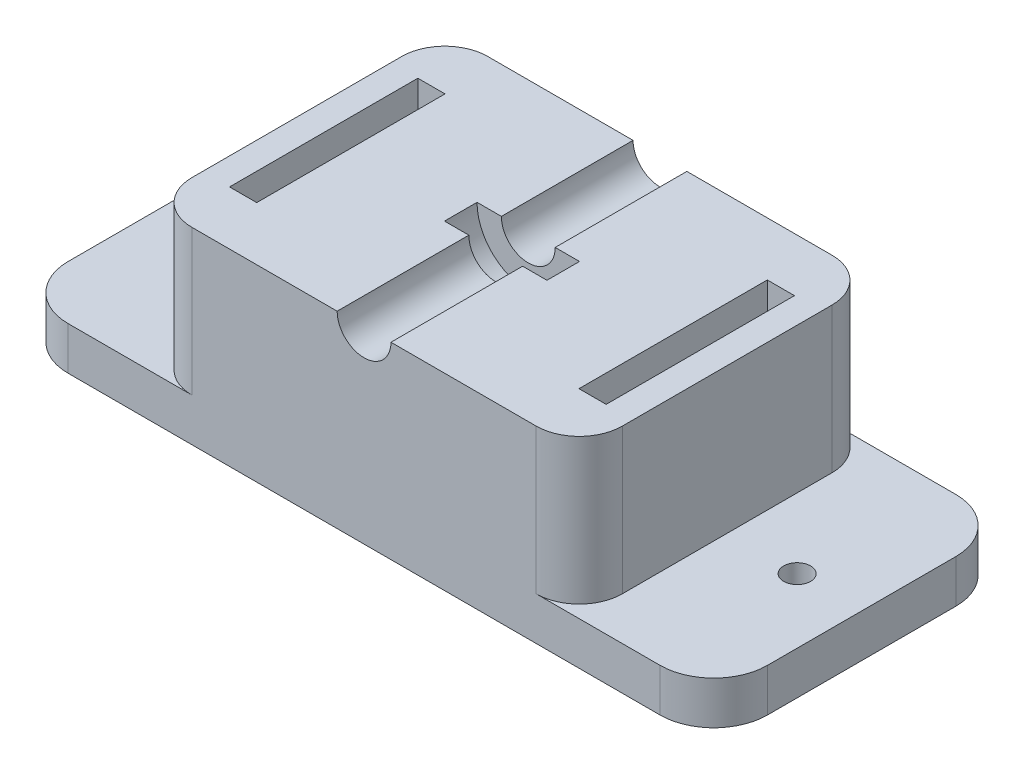
from build123d import *

# Parameters (mm, degrees)
SALIENTE_EXTRUIR1_DEPTH    = 55
CROQUIS2_R                 = 9.525
CORTAR_EXTRUIR1_DEPTH      = 3.025
CROQUIS3_W                 = 5.05
CROQUIS3_H                 = 35
CORTAR_EXTRUIR2_DEPTH      = 10
CORTAR_EXTRUIR3_DEPTH      = 79.779756283
CORTAR_EXTRUIR3_DEPTH_BACK = 79.779756283
CROQUIS4_R                 = 5
REDONDEO1_R                = 10
CROQUIS5_R                 = 2.5
CORTAR_EXTRUIR4_DEPTH      = 90.32524839
REDONDEO2_R                = 8


with BuildPart() as part:
    # Croquis1 → Saliente-Extruir1 (new body)
    with BuildSketch(Plane.XY):
        Polygon((-40, 0), (40, 0), (40, -27), (65, -27), (65, -35), (40, -35), (-40, -35), (-65, -35), (-65, -27), (-40, -27), align=None)
    extrude(amount=SALIENTE_EXTRUIR1_DEPTH)

    # Croquis2 → Cortar-Extruir1 (cut, symmetric)
    with BuildSketch(Plane.XY.offset(27.5)):
        Circle(CROQUIS2_R)
    extrude(amount=CORTAR_EXTRUIR1_DEPTH, both=True, mode=Mode.SUBTRACT)

    # Croquis3 → Cortar-Extruir2 (cut)
    with BuildSketch(Plane(origin=(0, 0, 0), x_dir=(1, 0, 0), z_dir=(0, 1, 0))):
        with Locations((-32.475, -27.5)):
            Rectangle(CROQUIS3_W, CROQUIS3_H)
        with Locations((32.475, -27.5)):
            Rectangle(CROQUIS3_W, CROQUIS3_H)
    extrude(amount=-CORTAR_EXTRUIR2_DEPTH, mode=Mode.SUBTRACT)

    # Croquis4 → Cortar-Extruir3 (cut, two sides: drawn at the far end of the back side and taken through both)
    with BuildSketch(Plane.XY.offset(27.5).offset(-CORTAR_EXTRUIR3_DEPTH_BACK)):
        Circle(CROQUIS4_R)
    extrude(amount=CORTAR_EXTRUIR3_DEPTH + CORTAR_EXTRUIR3_DEPTH_BACK, mode=Mode.SUBTRACT)

    # Redondeo1
    redondeo1_edges = [part.edges().sort_by_distance(p)[0] for p in [
        (65, -31, 0),
        (-65, -31, 0),
        (65, -31, 55),
        (-65, -31, 55),
    ]]
    fillet(redondeo1_edges, radius=REDONDEO1_R)

    # Croquis5 → Cortar-Extruir4 (cut, through all)
    with BuildSketch(Plane(origin=(0, -27, 0), x_dir=(1, 0, 0), z_dir=(0, 1, 0))):
        with Locations(Location((-53, -27.5, 0), (0, 0, 270))):
            Circle(CROQUIS5_R)
        with Locations(Location((53, -27.5, 0), (0, 0, 90))):
            Circle(CROQUIS5_R)
    extrude(amount=-CORTAR_EXTRUIR4_DEPTH, mode=Mode.SUBTRACT)

    # Redondeo2
    redondeo2_edges = [part.edges().sort_by_distance(p)[0] for p in [
        (-40, -13.5, 0),
        (40, -13.5, 0),
        (40, -13.5, 55),
        (-40, -13.5, 55),
    ]]
    fillet(redondeo2_edges, radius=REDONDEO2_R)


solid = part.part
